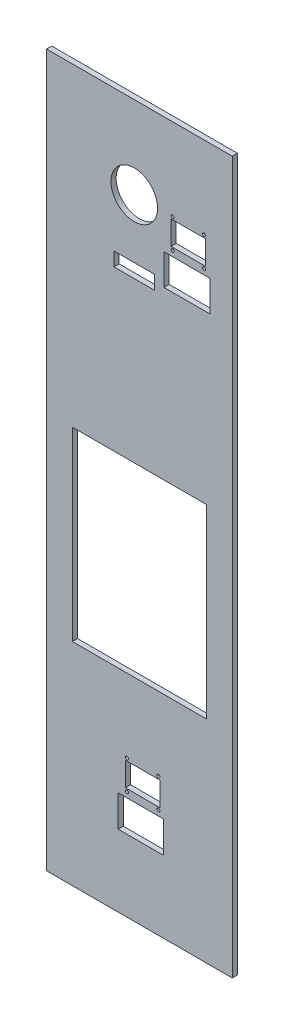
from build123d import *

# Parameters (mm, degrees)
ESQUISSE1_W             = 180
ESQUISSE1_H             = 790
BOSS_EXTRU_1_DEPTH      = 5
ESQUISSE2_W             = 130
ESQUISSE2_H             = 180
ENL_V_MAT_EXTRU_1_DEPTH = 406.154291598
ESQUISSE3_W             = 180
ESQUISSE3_H             = 100
ENL_V_MAT_EXTRU_2_DEPTH = 5
ESQUISSE4_R             = 22.583693943
ESQUISSE4_W             = 39.272250948
ESQUISSE4_H             = 13.375687181
ENL_V_MAT_EXTRU_3_DEPTH = 10
ESQUISSE6_R             = 1.5
ESQUISSE6_W             = 43.78333401
ESQUISSE6_H             = 30.495607997
ESQUISSE6_W_2           = 33.572233796
ESQUISSE6_H_2           = 23.130308998
ENL_V_MAT_EXTRU_4_DEPTH = 10
ESQUISSE7_R             = 1.5
ESQUISSE7_W             = 44.788511225
ESQUISSE7_H             = 29.879964446
ESQUISSE7_W_2           = 33.612496144
ESQUISSE7_H_2           = 23.111104951
ENL_V_MAT_EXTRU_5_DEPTH = 10


with BuildPart() as part:
    # Esquisse1 → Boss.-Extru.1 (new body)
    with BuildSketch(Plane.XY):
        Rectangle(ESQUISSE1_W, ESQUISSE1_H)
    extrude(amount=BOSS_EXTRU_1_DEPTH)

    # Esquisse2 → Enlèv. mat.-Extru.1 (cut, through all)
    with BuildSketch(Plane.XY.offset(5)):
        Rectangle(ESQUISSE2_W, ESQUISSE2_H)
    extrude(amount=-ENL_V_MAT_EXTRU_1_DEPTH, mode=Mode.SUBTRACT)

    # Esquisse3 → Enlèv. mat.-Extru.2 (cut)
    with BuildSketch(Plane.XY.offset(5)):
        with Locations((0, -345)):
            Rectangle(ESQUISSE3_W, ESQUISSE3_H)
    extrude(amount=-ENL_V_MAT_EXTRU_2_DEPTH, mode=Mode.SUBTRACT)

    # Esquisse4 → Enlèv. mat.-Extru.3 (cut)
    with BuildSketch(Plane.XY.offset(5)):
        with Locations((-5, 315.089745962)):
            Circle(ESQUISSE4_R)
        with Locations((-5, 251.402324932)):
            Rectangle(ESQUISSE4_W, ESQUISSE4_H)
    extrude(amount=-ENL_V_MAT_EXTRU_3_DEPTH, mode=Mode.SUBTRACT)

    # Esquisse6 → Enlèv. mat.-Extru.4 (cut)
    with BuildSketch(Plane.XY.offset(5)):
        with Locations((-12.09, -189.669997694)):
            Circle(ESQUISSE6_R)
        with Locations((18.36, -189.669997694)):
            Circle(ESQUISSE6_R)
        with Locations((18.36, -161.269997694)):
            Circle(ESQUISSE6_R)
        with Locations((-12.09, -161.269997694)):
            Circle(ESQUISSE6_R)
        with Locations((1.217144904, -210.087843678)):
            Rectangle(ESQUISSE6_W, ESQUISSE6_H)
        with Locations((3.160802391, -175.467764734)):
            Rectangle(ESQUISSE6_W_2, ESQUISSE6_H_2)
    extrude(amount=-ENL_V_MAT_EXTRU_4_DEPTH, mode=Mode.SUBTRACT)

    # Esquisse7 → Enlèv. mat.-Extru.5 (cut)
    with BuildSketch(Plane.XY.offset(5)):
        with Locations((62.66, 315.355)):
            Circle(ESQUISSE7_R)
        with Locations((32.21, 315.355)):
            Circle(ESQUISSE7_R)
        with Locations((32.21, 286.955)):
            Circle(ESQUISSE7_R)
        with Locations((62.66, 286.955)):
            Circle(ESQUISSE7_R)
        with Locations((46.118085251, 266.662403555)):
            Rectangle(ESQUISSE7_W, ESQUISSE7_H)
        with Locations((47.453751928, 301.139447525)):
            Rectangle(ESQUISSE7_W_2, ESQUISSE7_H_2)
    extrude(amount=-ENL_V_MAT_EXTRU_5_DEPTH, mode=Mode.SUBTRACT)


solid = part.part
